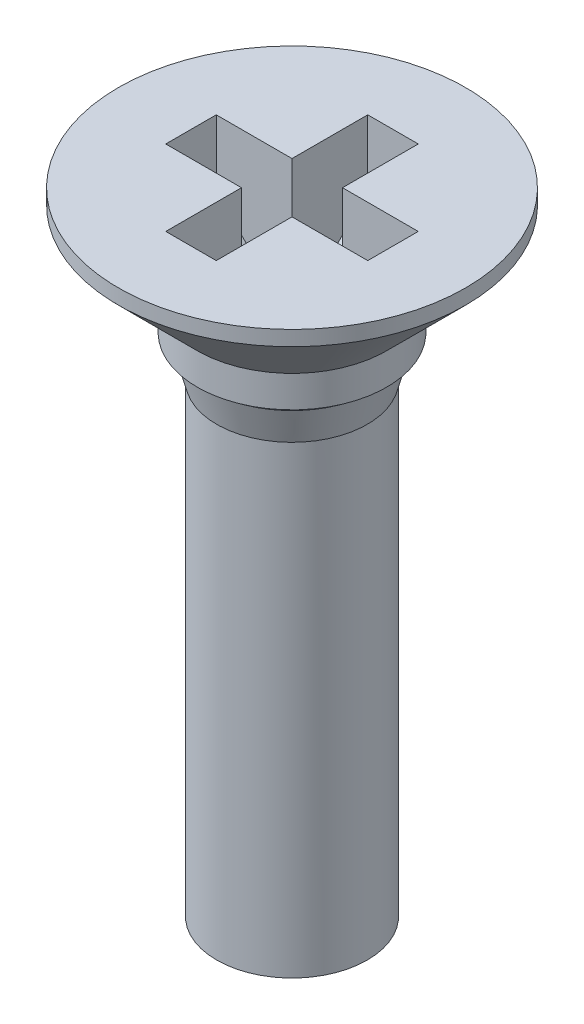
from build123d import *

# Parameters (mm, degrees)
KREUZSCHLITZ1_H_DEPTH      = 0.4
KREUZSCHLITZ1_H_DEPTH_BACK = 0.4
KREUZSCHLITZ2_H_DEPTH      = 0.4
KREUZSCHLITZ2_H_DEPTH_BACK = 0.4
BOSS_EXTRUDE1_START        = 2
SKETCH1_R                  = 1.1935
BOSS_EXTRUDE1_DEPTH        = 2


with BuildPart() as part:
    # Skizze1 → Basis-Rotation (revolve)
    with BuildSketch(Plane.XY, mode=Mode.PRIVATE) as basis_rotation_sk:
        Polygon((0, 0), (2.75, 0), (2.75, -0.2375), (1.5, -1.4875), (1.5, -1.9875), (1.3375, -1.9875), (1.3375, -2.112584684), (1.1935, -2.65), (1.1935, -8), (0, -8), align=None)
    revolve(basis_rotation_sk.sketch.rotate(Axis((0, 0, 0), (0, -1, 0)), 180), axis=Axis((0, 0, 0), (0, -1, 0)))

    # Skizze2 → Kreuzschlitz1 H (cut, two sides: drawn at the far end of the back side and taken through both)
    with BuildSketch(Plane.XY.offset(-KREUZSCHLITZ1_H_DEPTH_BACK)):
        Polygon((-0.55, -2.1), (0.55, -2.1), (1.6, -1.05), (1.6, 0), (-1.6, 0), (-1.6, -1.05), align=None)
    extrude(amount=KREUZSCHLITZ1_H_DEPTH + KREUZSCHLITZ1_H_DEPTH_BACK, mode=Mode.SUBTRACT)

    # Skizze3 → Kreuzschlitz2 H (cut, two sides: drawn at the far end of the back side and taken through both)
    with BuildSketch(Plane(origin=(0, 0, 0), x_dir=(0, 0, -1), z_dir=(1, 0, 0)).offset(-KREUZSCHLITZ2_H_DEPTH_BACK)):
        Polygon((-0.55, -2.1), (0.55, -2.1), (1.6, -1.05), (1.6, 0), (-1.6, 0), (-1.6, -1.05), align=None)
    extrude(amount=KREUZSCHLITZ2_H_DEPTH + KREUZSCHLITZ2_H_DEPTH_BACK, mode=Mode.SUBTRACT)

    # Sketch1 → Boss-Extrude1 (add)
    with BuildSketch(Plane.XZ.offset(8).offset(BOSS_EXTRUDE1_START)):
        with Locations(Location((0, 0, 0), (0, 0, 180))):
            Circle(SKETCH1_R)
    extrude(amount=-BOSS_EXTRUDE1_DEPTH)


solid = part.part
